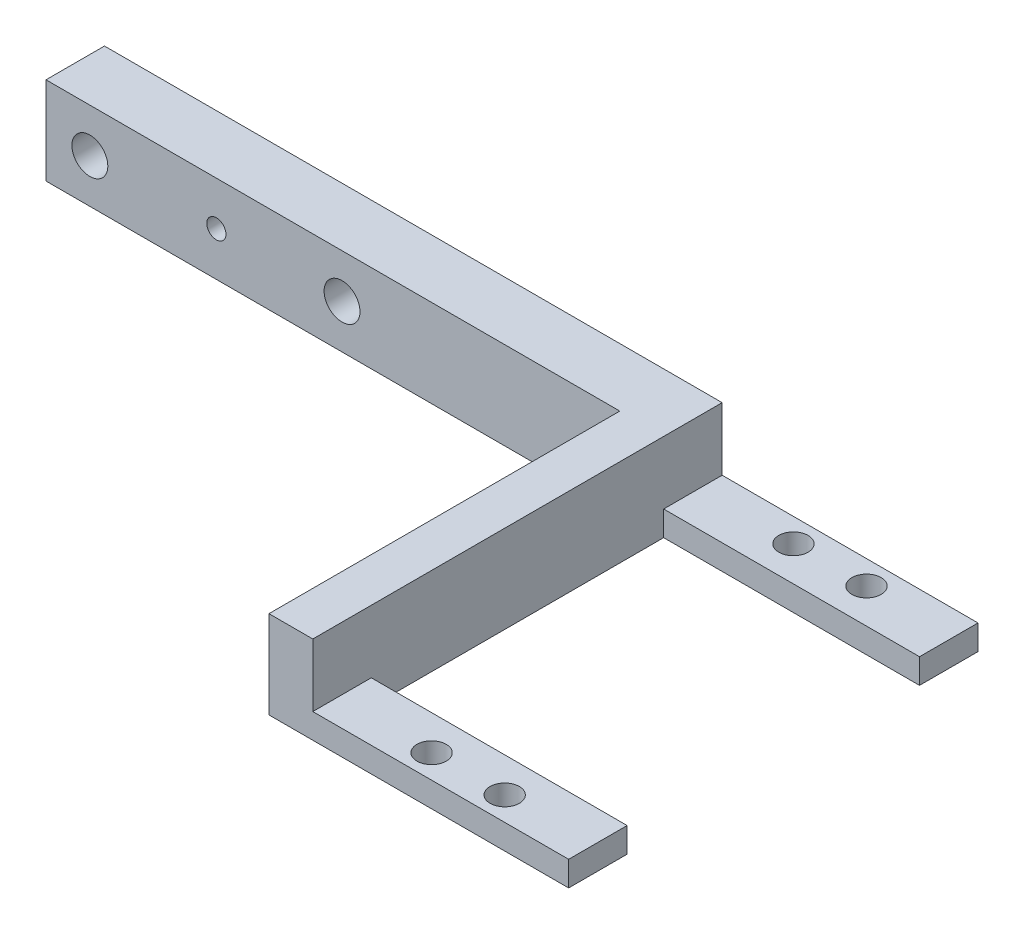
from build123d import *

# Parameters (mm, degrees)
SKETCH8_W           = 84.5
SKETCH8_H           = 12
SKETCH8_R           = 2.456134815
BOSS_EXTRUDE4_DEPTH = 8
SKETCH9_R           = 3.5
CUT_EXTRUDE3_DEPTH  = 2
SKETCH10_W          = 6
SKETCH10_H          = 12
BOSS_EXTRUDE5_DEPTH = 48
SKETCH11_W          = 8
SKETCH11_H          = 3.4
BOSS_EXTRUDE6_DEPTH = 35
SKETCH12_R          = 2
CUT_EXTRUDE4_DEPTH  = 35
SKETCH13_R          = 1.310160124
CUT_EXTRUDE5_DEPTH  = 10


with BuildPart() as part:
    # Sketch8 → Boss-Extrude4 (new body)
    with BuildSketch(Plane.XY):
        with Locations((17.439173688, 7.621093459)):
            Rectangle(SKETCH8_W, SKETCH8_H)
        with Locations((-18.810826312, 7.621093459)):
            Circle(SKETCH8_R, mode=Mode.SUBTRACT)
        with Locations((15.689173688, 7.621093459)):
            Circle(SKETCH8_R, mode=Mode.SUBTRACT)
    extrude(amount=BOSS_EXTRUDE4_DEPTH)

    # Sketch9 → Cut-Extrude3 (cut)
    with BuildSketch(Plane(origin=(0, 0, 0), x_dir=(-1, 0, 0), z_dir=(0, 0, -1))):
        with Locations((-15.689173688, 7.621093459)):
            Circle(SKETCH9_R)
        with Locations((18.810826312, 7.621093459)):
            Circle(SKETCH9_R)
    extrude(amount=-CUT_EXTRUDE3_DEPTH, mode=Mode.SUBTRACT)

    # Sketch10 → Boss-Extrude5 (add)
    with BuildSketch(Plane.XY.offset(8)):
        with Locations((56.689173688, 7.621093459)):
            Rectangle(SKETCH10_W, SKETCH10_H)
    extrude(amount=BOSS_EXTRUDE5_DEPTH)

    # Sketch11 → Boss-Extrude6 (add)
    with BuildSketch(Plane(origin=(59.689173688, 0, 0), x_dir=(0, 0, -1), z_dir=(1, 0, 0))):
        with Locations((-4, 3.321093459)):
            Rectangle(SKETCH11_W, SKETCH11_H)
        with Locations((-52, 3.321093459)):
            Rectangle(SKETCH11_W, SKETCH11_H)
    extrude(amount=BOSS_EXTRUDE6_DEPTH)

    # Sketch12 → Cut-Extrude4 (cut)
    with BuildSketch(Plane(origin=(0, 5.021093459, 0), x_dir=(1, 0, 0), z_dir=(0, 1, 0))):
        with Locations((72.689173688, -3.25)):
            Circle(SKETCH12_R)
        with Locations((82.689173688, -3.25)):
            Circle(SKETCH12_R)
        with Locations((72.689173688, -52.75)):
            Circle(SKETCH12_R)
        with Locations((82.689173688, -52.75)):
            Circle(SKETCH12_R)
    extrude(amount=-CUT_EXTRUDE4_DEPTH, mode=Mode.SUBTRACT)

    # Sketch13 → Cut-Extrude5 (cut)
    with BuildSketch(Plane(origin=(0, 0, 0), x_dir=(-1, 0, 0), z_dir=(0, 0, -1))):
        with Locations((1.505343306, 7.621093459)):
            Circle(SKETCH13_R)
    extrude(amount=-CUT_EXTRUDE5_DEPTH, mode=Mode.SUBTRACT)


solid = part.part
